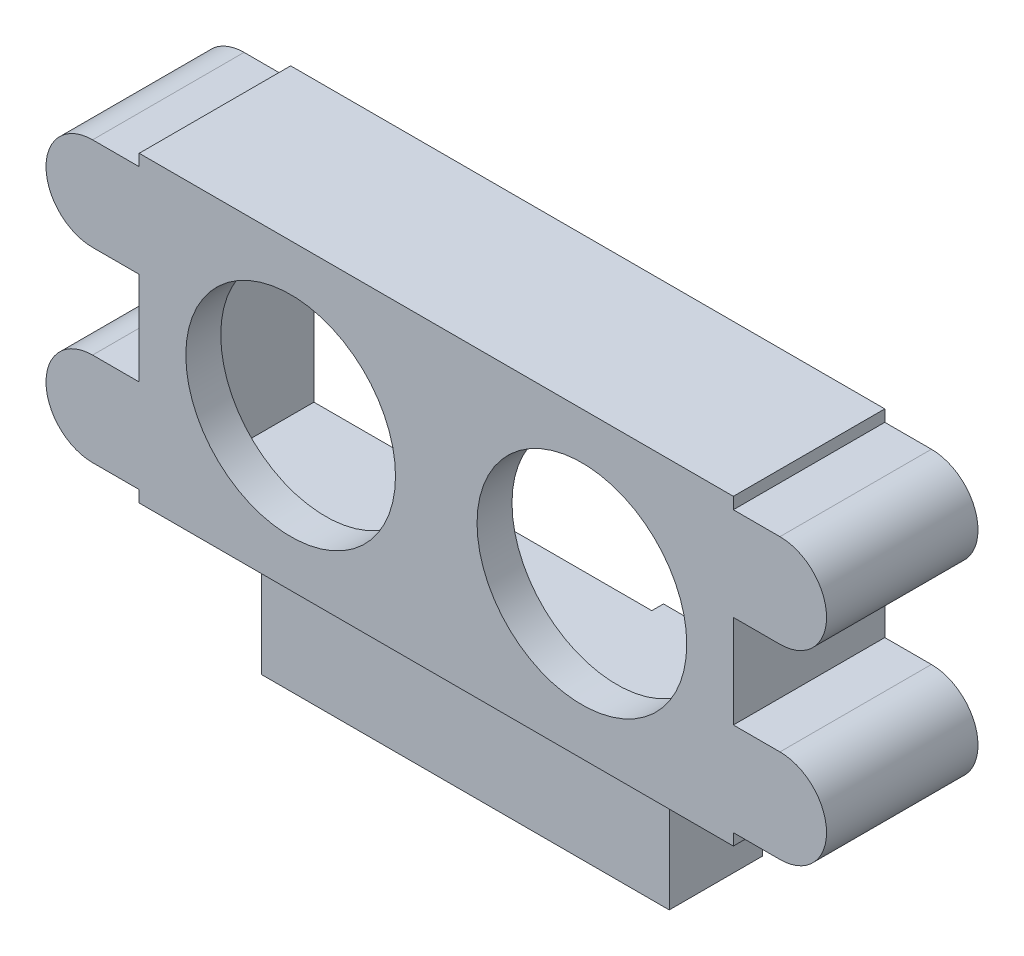
from build123d import *

# Parameters (mm, degrees)
SKIZZE1_W                            = 51
SKIZZE1_H                            = 26
SKIZZE1_R                            = 9
AUFSATZ_LINEAR_AUSTRAGEN1_DEPTH      = 3
SKIZZE3_W                            = 51
SKIZZE3_H                            = 26
SKIZZE3_W_2                          = 47
SKIZZE3_H_2                          = 22
AUFSATZ_LINEAR_AUSTRAGEN3_DEPTH      = 10
AUFSATZ_LINEAR_AUSTRAGEN4_DEPTH      = 13
F_3_0_3_DURCHMESSER_BOHRUNG1_D       = 3
F_3_0_3_DURCHMESSER_BOHRUNG1_DEPTH   = 8
F_3_0_3_DURCHMESSER_BOHRUNG1_TIP     = 0.901290929
SCHNITT_LINEAR_AUSTRAGEN1_REACH      = 562.445
SKIZZE8_W                            = 13
SKIZZE8_H                            = 1
SKIZZE10_W                           = 35
SKIZZE10_H                           = 8
AUFSATZ_LINEAR_AUSTRAGEN5_DEPTH      = 10
F_1_5_1_5_DURCHMESSER_BOHRUNG1_D     = 1.5
F_1_5_1_5_DURCHMESSER_BOHRUNG1_DEPTH = 8
F_1_5_1_5_DURCHMESSER_BOHRUNG1_TIP   = 0.450645464


with BuildPart() as part:
    # Skizze1 → Aufsatz-Linear austragen1 (new body)
    with BuildSketch(Plane.XY):
        with Locations((526.252498469, 200.343199998)):
            Rectangle(SKIZZE1_W, SKIZZE1_H)
        with Locations((513.752498469, 200.343199998)):
            Circle(SKIZZE1_R, mode=Mode.SUBTRACT)
        with Locations((538.752498469, 200.343199998)):
            Circle(SKIZZE1_R, mode=Mode.SUBTRACT)
    extrude(amount=AUFSATZ_LINEAR_AUSTRAGEN1_DEPTH)

    # Skizze3 → Aufsatz-Linear austragen3 (add)
    with BuildSketch(Plane(origin=(0, 0, 0), x_dir=(-1, 0, 0), z_dir=(0, 0, -1))):
        with Locations((-526.252498469, 200.343199998)):
            Rectangle(SKIZZE3_W, SKIZZE3_H)
        with Locations((-526.252498469, 200.343199998)):
            Rectangle(SKIZZE3_W_2, SKIZZE3_H_2, mode=Mode.SUBTRACT)
    extrude(amount=AUFSATZ_LINEAR_AUSTRAGEN3_DEPTH)

    # Skizze4 → Aufsatz-Linear austragen4 (add)
    with BuildSketch(Plane(origin=(0, 0, -10), x_dir=(-1, 0, 0), z_dir=(0, 0, -1))):
        with BuildLine():
            Line((-496.752498469, 212.343199998), (-500.752498469, 212.343199998))
            Line((-500.752498469, 212.343199998), (-500.752498469, 204.343199998))
            Line((-500.752498469, 204.343199998), (-496.752498469, 204.343199998))
            ThreePointArc((-496.752498469, 204.343199998), (-492.752498469, 208.343199998), (-496.752498469, 212.343199998))
        make_face()
        with BuildLine():
            Line((-500.752498469, 196.343199998), (-496.752498469, 196.343199998))
            ThreePointArc((-496.752498469, 196.343199998), (-492.752498469, 192.343199998), (-496.752498469, 188.343199998))
            Line((-496.752498469, 188.343199998), (-500.752498469, 188.343199998))
            Line((-500.752498469, 188.343199998), (-500.752498469, 196.343199998))
        make_face()
        with BuildLine():
            Line((-551.752498469, 188.343199998), (-551.752498469, 196.343199998))
            Line((-551.752498469, 196.343199998), (-555.752498469, 196.343199998))
            ThreePointArc((-555.752498469, 196.343199998), (-559.752498469, 192.343199998), (-555.752498469, 188.343199998))
            Line((-555.752498469, 188.343199998), (-551.752498469, 188.343199998))
        make_face()
        with BuildLine():
            Line((-551.752498469, 204.343199998), (-555.752498469, 204.343199998))
            ThreePointArc((-555.752498469, 204.343199998), (-559.752498469, 208.343199998), (-555.752498469, 212.343199998))
            Line((-555.752498469, 212.343199998), (-551.752498469, 212.343199998))
            Line((-551.752498469, 212.343199998), (-551.752498469, 204.343199998))
        make_face()
    extrude(amount=-AUFSATZ_LINEAR_AUSTRAGEN4_DEPTH)

    # Ø3.0 (3) Durchmesser Bohrung1
    with Locations(Plane(origin=(0, 0, -10), x_dir=(-1, 0, 0), z_dir=(0, 0, -1))):
        with Locations((-555.752498469, 208.343199998), (-555.752498469, 192.343199998), (-496.752498469, 208.343199998), (-496.752498469, 192.343199998)):
            Hole(F_3_0_3_DURCHMESSER_BOHRUNG1_D / 2, depth=F_3_0_3_DURCHMESSER_BOHRUNG1_DEPTH)
            with Locations((0, 0, -(F_3_0_3_DURCHMESSER_BOHRUNG1_DEPTH + F_3_0_3_DURCHMESSER_BOHRUNG1_TIP / 2))):  # 118° drill point
                Cone(0, F_3_0_3_DURCHMESSER_BOHRUNG1_D / 2, F_3_0_3_DURCHMESSER_BOHRUNG1_TIP, mode=Mode.SUBTRACT)

    # Skizze8 → Schnitt-Linear austragen1 (cut, up to next)
    with BuildSketch(Plane.XZ.offset(-187.343199998), mode=Mode.PRIVATE) as schnitt_linear_austragen1_sk1:
        with Locations((526.252498469, -9.5)):
            Rectangle(SKIZZE8_W, SKIZZE8_H)
    schnitt_linear_austragen1_tool1 = extrude(schnitt_linear_austragen1_sk1.sketch, amount=-SCHNITT_LINEAR_AUSTRAGEN1_REACH, mode=Mode.PRIVATE) & part.part
    add(schnitt_linear_austragen1_tool1.solids().sort_by_distance((526.252498, 187.3432, -9.5))[0], mode=Mode.SUBTRACT)

    # Skizze10 → Aufsatz-Linear austragen5 (add)
    with BuildSketch(Plane.XZ.offset(-187.343199998)):
        with Locations((526.252498469, -3.5)):
            Rectangle(SKIZZE10_W, SKIZZE10_H)
    extrude(amount=AUFSATZ_LINEAR_AUSTRAGEN5_DEPTH)

    # Ø1.5 (1.5) Durchmesser Bohrung1
    with Locations(Plane(origin=(0, 177.343199998, 0), x_dir=(-1, 0, 0), z_dir=(0, -1, 0))):
        with Locations((-535.702498469, 3.5), (-516.802498469, 3.5)):
            Hole(F_1_5_1_5_DURCHMESSER_BOHRUNG1_D / 2, depth=F_1_5_1_5_DURCHMESSER_BOHRUNG1_DEPTH)
            with Locations((0, 0, -(F_1_5_1_5_DURCHMESSER_BOHRUNG1_DEPTH + F_1_5_1_5_DURCHMESSER_BOHRUNG1_TIP / 2))):  # 118° drill point
                Cone(0, F_1_5_1_5_DURCHMESSER_BOHRUNG1_D / 2, F_1_5_1_5_DURCHMESSER_BOHRUNG1_TIP, mode=Mode.SUBTRACT)


solid = part.part
